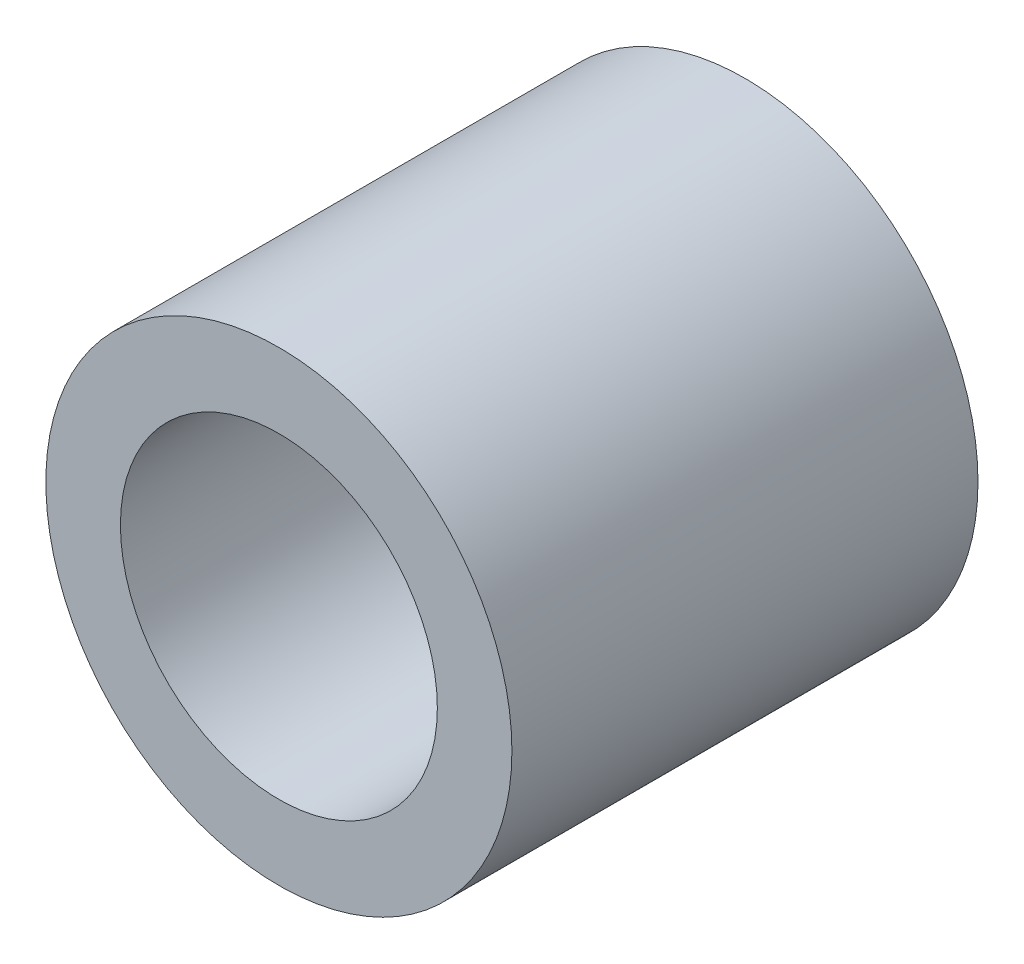
from build123d import *

# Parameters (mm, degrees)
SKETCH_1_R      = 2.5
SKETCH_1_R_2    = 1.7
EXTRUDE_1_DEPTH = 5


with BuildPart() as part:
    # ｽｹｯﾁ1 → ﾎﾞｽ - 押し出し1 (new body)
    with BuildSketch(Plane.XY):
        with Locations((-0.962098668, 1.445493574)):
            Circle(SKETCH_1_R)
        with Locations((-0.962098668, 1.445493574)):
            Circle(SKETCH_1_R_2, mode=Mode.SUBTRACT)
    extrude(amount=EXTRUDE_1_DEPTH)


solid = part.part
